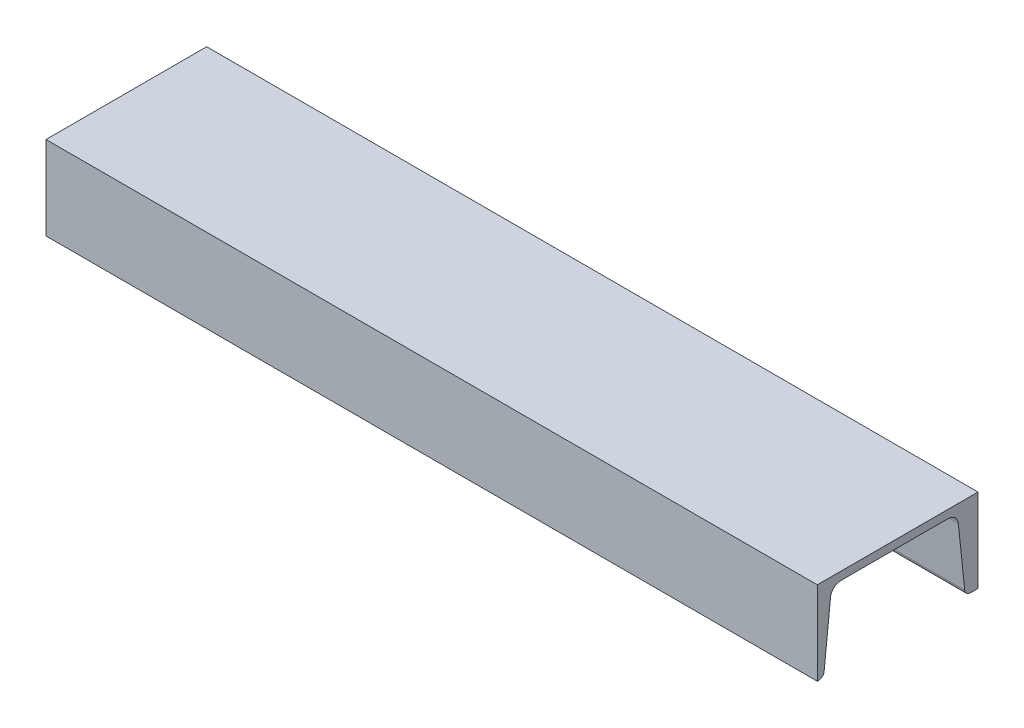
from build123d import *

# Parameters (mm, degrees)
C_CHANNEL_120_X_12_1_DEPTH = 600


with BuildPart() as part:
    # Sketch11 → C channel 120 X 12(1) (new body)
    with BuildSketch(Plane(origin=(0, 0, 0), x_dir=(0, -1, 0), z_dir=(-1, 0, 0))):
        with BuildLine():
            Line((65, 125), (0, 125))
            Line((0, 125), (0, 0))
            Line((0, 0), (65, 0))
            Line((65, 0), (65, 5.845330836))
            ThreePointArc((65, 5.845330836), (63.844151715, 8.856418565), (60.970378085, 10.320679365))
            Line((60.970378085, 10.320679365), (13.463772294, 15.313824837))
            ThreePointArc((13.463772294, 15.313824837), (8.354841396, 17.916955149), (6.3, 23.27))
            Line((6.3, 23.27), (6.3, 106.74))
            ThreePointArc((6.3, 106.74), (8.354841396, 112.093044851), (13.463772294, 114.696175163))
            Line((13.463772294, 114.696175163), (60.970378085, 119.689320635))
            ThreePointArc((60.970378085, 119.689320635), (63.844151715, 121.153581435), (65, 124.164669164))
            Line((65, 124.164669164), (65, 125))
        make_face()
    extrude(amount=C_CHANNEL_120_X_12_1_DEPTH)


solid = part.part
